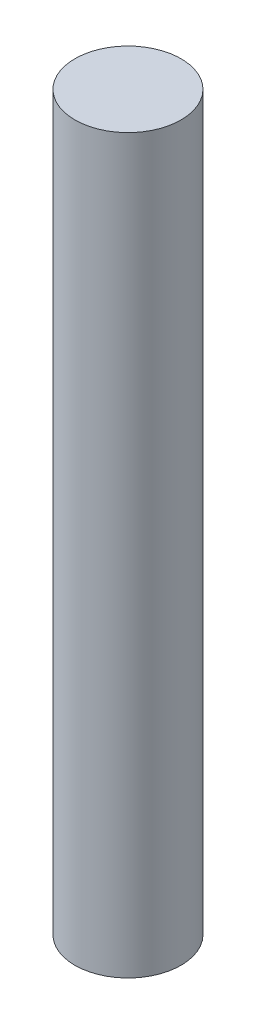
from build123d import *

# Parameters (mm, degrees)
SKETCH_1_R      = 5
EXTRUDE_1_DEPTH = 69


with BuildPart() as part:
    # 草图1 → 凸台-拉伸1 (new body)
    with BuildSketch(Plane(origin=(0, 0, 0), x_dir=(1, 0, 0), z_dir=(0, 1, 0))):
        with Locations(Location((0, 0, 0), (0, 0, 270))):
            Circle(SKETCH_1_R)
    extrude(amount=EXTRUDE_1_DEPTH)


solid = part.part
